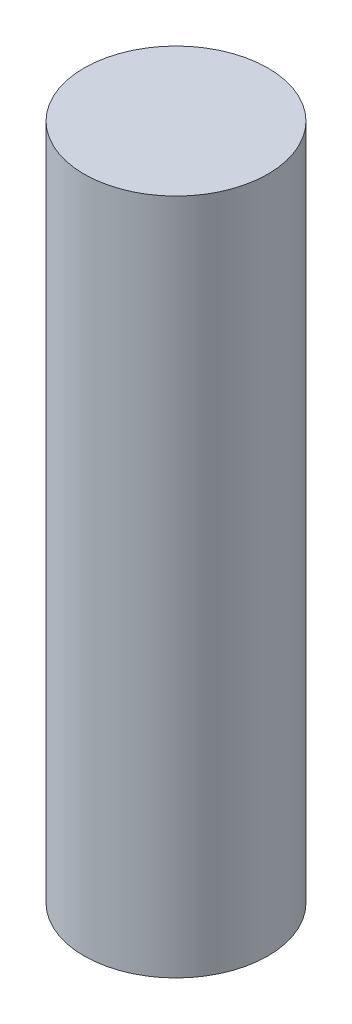
from build123d import *

# Parameters (mm, degrees)
ESBO_O1_R                = 7.5
RESSALTO_EXTRUS_O1_DEPTH = 55.25


with BuildPart() as part:
    # Esboço1 → Ressalto-extrusão1 (new body)
    with BuildSketch(Plane(origin=(0, 0, 0), x_dir=(1, 0, 0), z_dir=(0, 1, 0))):
        with Locations(Location((0, 0, 0), (0, 0, 270))):
            Circle(ESBO_O1_R)
    extrude(amount=RESSALTO_EXTRUS_O1_DEPTH)


solid = part.part
